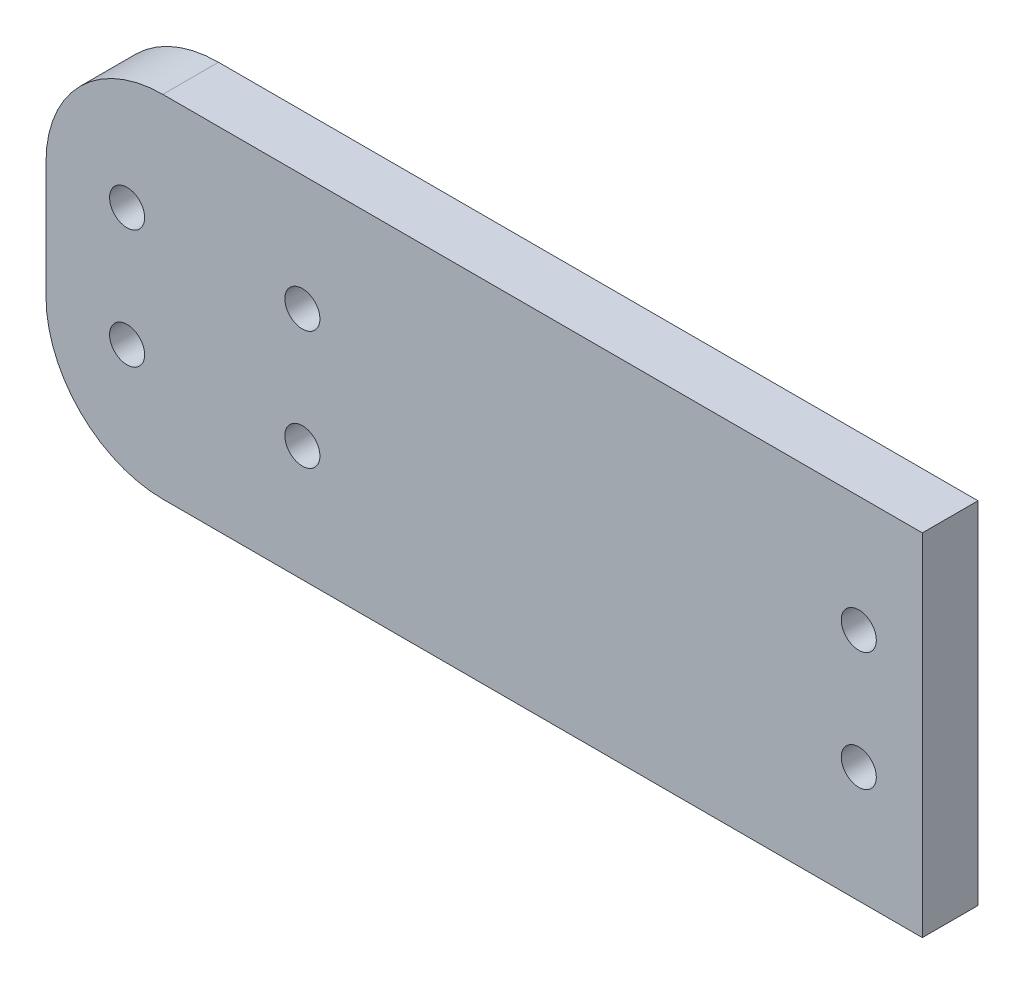
from build123d import *

# Parameters (mm, degrees)
ESQUISSE1_W             = 75
ESQUISSE1_H             = 30
BOSS_EXTRU_1_DEPTH      = 4.7625
CONG_1_R                = 10
ESQUISSE3_R             = 1.5
ENL_V_MAT_EXTRU_3_DEPTH = 10


with BuildPart() as part:
    # Esquisse1 → Boss.-Extru.1 (new body)
    with BuildSketch(Plane.XY):
        Rectangle(ESQUISSE1_W, ESQUISSE1_H)
    extrude(amount=BOSS_EXTRU_1_DEPTH)

    # Congé1
    cong_1_edges = [part.edges().sort_by_distance(p)[0] for p in [
        (-37.5, -15, 2.38125),
        (-37.5, 15, 2.38125),
    ]]
    fillet(cong_1_edges, radius=CONG_1_R)

    # Esquisse3 → Enlèv. mat.-Extru.3 (cut)
    with BuildSketch(Plane.XY.offset(4.7625)):
        with Locations((-15.56, 5.08)):
            Circle(ESQUISSE3_R)
        with Locations((-15.56, -5.08)):
            Circle(ESQUISSE3_R)
        with Locations((32.06, -5.08)):
            Circle(ESQUISSE3_R)
        with Locations((32.06, 5.08)):
            Circle(ESQUISSE3_R)
        with Locations((-30.56, 5.08)):
            Circle(ESQUISSE3_R)
        with Locations((-30.56, -5.08)):
            Circle(ESQUISSE3_R)
    extrude(amount=-ENL_V_MAT_EXTRU_3_DEPTH, mode=Mode.SUBTRACT)


solid = part.part
